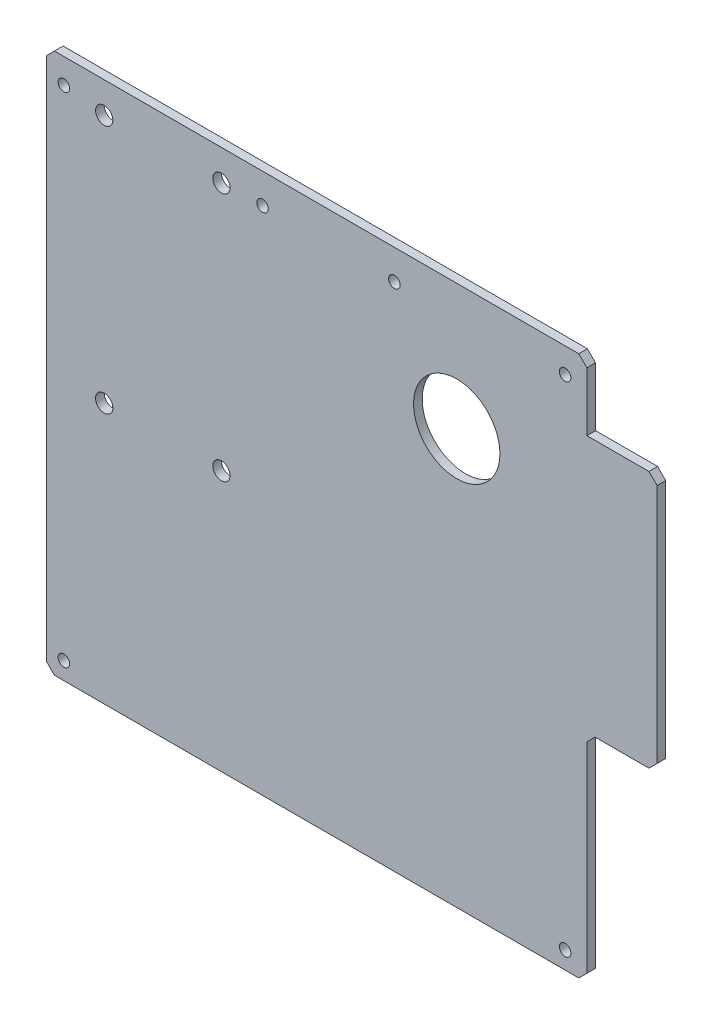
from build123d import *

# Parameters (mm, degrees)
SKETCH1_R           = 1.5
SKETCH1_R_2         = 1
SKETCH1_R_3         = 7.502494881
BOSS_EXTRUDE2_DEPTH = 1.5


with BuildPart() as part:
    # Sketch1 → Boss-Extrude2 (new body)
    with BuildSketch(Plane.XY):
        Polygon((89.453108516, 4.337043032), (-1.643229796, 4.337043032), (-3.057443358, 2.92282947), (-3.057443358, -88.173508842), (-1.643229796, -89.587722405), (89.453108516, -89.587722405), (90.867322078, -88.173508842), (90.867322078, -53.341657496), (92.281535641, -51.927443934), (101.643338186, -51.927443934), (103.057551748, -50.513230371), (103.057551748, -8.692923399), (101.643338186, -7.278709837), (90.867322078, -7.278709837), (90.867322078, 2.92282947), align=None)
        with Locations((7.002900718, -1.018478259)):
            Circle(SKETCH1_R, mode=Mode.SUBTRACT)
        with Locations((27.371818874, -1.018478259)):
            Circle(SKETCH1_R, mode=Mode.SUBTRACT)
        with Locations((34.50904124, -0.868109843)):
            Circle(SKETCH1_R_2, mode=Mode.SUBTRACT)
        with Locations((57.413525643, -0.868109843)):
            Circle(SKETCH1_R_2, mode=Mode.SUBTRACT)
        with Locations((87.07937983, 0.003106997)):
            Circle(SKETCH1_R_2, mode=Mode.SUBTRACT)
        with Locations((68.250695172, -17.55885203)):
            Circle(SKETCH1_R_3, mode=Mode.SUBTRACT)
        with Locations((7.002900718, -44.317247133)):
            Circle(SKETCH1_R, mode=Mode.SUBTRACT)
        with Locations((27.371818874, -44.317247133)):
            Circle(SKETCH1_R, mode=Mode.SUBTRACT)
        with Locations((0, -86.555222321)):
            Circle(SKETCH1_R_2, mode=Mode.SUBTRACT)
        with Locations((87.07937983, -86.555222321)):
            Circle(SKETCH1_R_2, mode=Mode.SUBTRACT)
        Circle(SKETCH1_R_2, mode=Mode.SUBTRACT)
    extrude(amount=BOSS_EXTRUDE2_DEPTH)


solid = part.part
